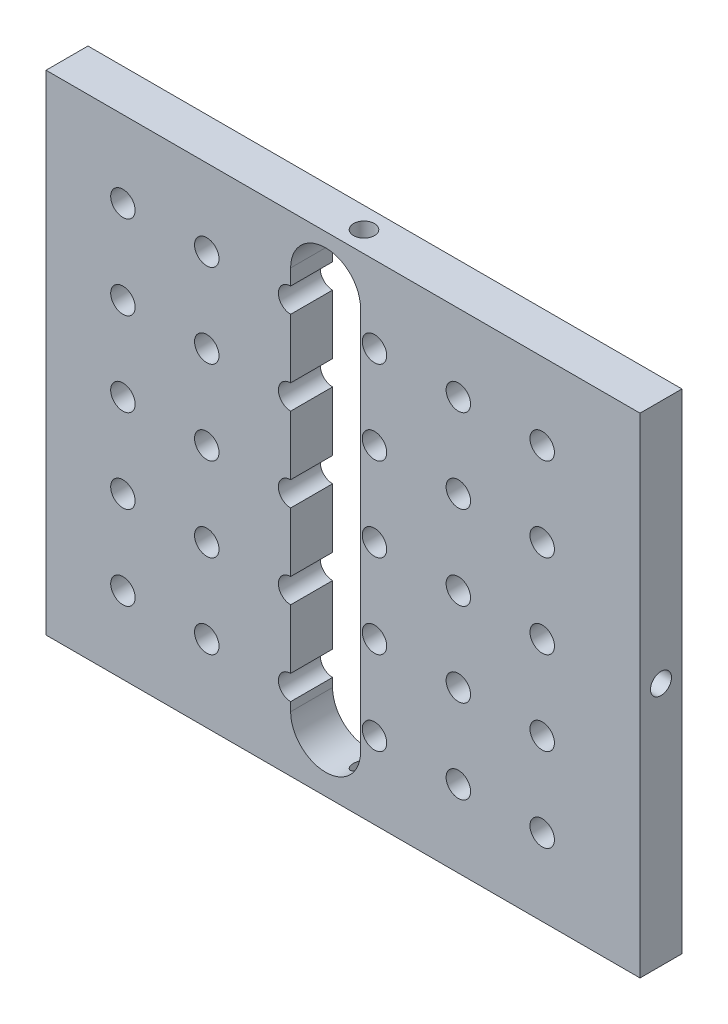
from build123d import *

# Parameters (mm, degrees)
ESQUISSE1_W                     = 85
ESQUISSE1_H                     = 70
BOSS_EXTRU_1_DEPTH              = 6
ESQUISSE3_R                     = 1.5
ENL_V_MAT_EXTRU_5_DEPTH         = 5
ESQUISSE5_R                     = 1.75
ENL_V_MAT_EXTRU_6_DEPTH         = 6
R_P_TITION_LIN_AIRE2_COUNT      = 6
R_P_TITION_LIN_AIRE2_PITCH      = 12
R_P_TITION_LIN_AIRE2_COUNT_DIR2 = 5
R_P_TITION_LIN_AIRE2_PITCH_DIR2 = 12
ESQUISSE8_R                     = 1.5
ENL_V_MAT_EXTRU_8_DEPTH         = 5
CUT_EXTRUDE2_DEPTH              = 56.38275905


with BuildPart() as part:
    # Esquisse1 → Boss.-Extru.1 (new body)
    with BuildSketch(Plane.XY):
        Rectangle(ESQUISSE1_W, ESQUISSE1_H)
    extrude(amount=BOSS_EXTRU_1_DEPTH)

    # Esquisse3 → Enlèv. mat.-Extru.5 (cut)
    with BuildSketch(Plane.ZY.offset(42.5)):
        with Locations((3, 0)):
            Circle(ESQUISSE3_R)
    enl_v_mat_extru_5 = extrude(amount=-ENL_V_MAT_EXTRU_5_DEPTH, mode=Mode.SUBTRACT)

    # Symétrie1: Enlèv. mat.-Extru.5 across plane
    add(enl_v_mat_extru_5.mirror(Plane(origin=(0, 0, 0), x_dir=(0, 0, 1), z_dir=(1, 0, 0))), mode=Mode.SUBTRACT)

    # Esquisse5 → Enlèv. mat.-Extru.6 (cut)
    with BuildSketch(Plane.XY):
        with Locations(Location((-31.5, -24, 0), (0, 0, 180))):
            Circle(ESQUISSE5_R)
    enl_v_mat_extru_6 = extrude(amount=ENL_V_MAT_EXTRU_6_DEPTH, mode=Mode.SUBTRACT)

    # Répétition linéaire2: Enl_v. mat.-Extru.6 6 × 5
    with Locations(*[(i * R_P_TITION_LIN_AIRE2_PITCH, j * R_P_TITION_LIN_AIRE2_PITCH_DIR2, 0) for i in range(R_P_TITION_LIN_AIRE2_COUNT) for j in range(R_P_TITION_LIN_AIRE2_COUNT_DIR2) if (i, j) != (0, 0)]):
        add(enl_v_mat_extru_6, mode=Mode.SUBTRACT)

    # Esquisse8 → Enlèv. mat.-Extru.8 (cut)
    with BuildSketch(Plane(origin=(0, 35, 0), x_dir=(1, 0, 0), z_dir=(0, 1, 0))):
        with Locations(Location((0, -3, 0), (0, 0, 270))):
            Circle(ESQUISSE8_R)
    enl_v_mat_extru_8 = extrude(amount=-ENL_V_MAT_EXTRU_8_DEPTH, mode=Mode.SUBTRACT)

    # Symétrie2: Enlèv. mat.-Extru.8 across plane
    add(enl_v_mat_extru_8.mirror(Plane.ZX), mode=Mode.SUBTRACT)

    # Sketch1 → Cut-Extrude2 (cut, through all)
    with BuildSketch(Plane(origin=(0, 0, 0), x_dir=(-1, 0, 0), z_dir=(0, 0, -1))):
        with BuildLine():
            Line((-2.5, -27), (-2.5, 28))
            ThreePointArc((-2.5, 28), (2.5, 33), (7.5, 28))
            Line((7.5, 28), (7.5, -27))
            ThreePointArc((7.5, -27), (2.5, -32), (-2.5, -27))
        make_face()
    extrude(amount=-CUT_EXTRUDE2_DEPTH, mode=Mode.SUBTRACT)


solid = part.part
